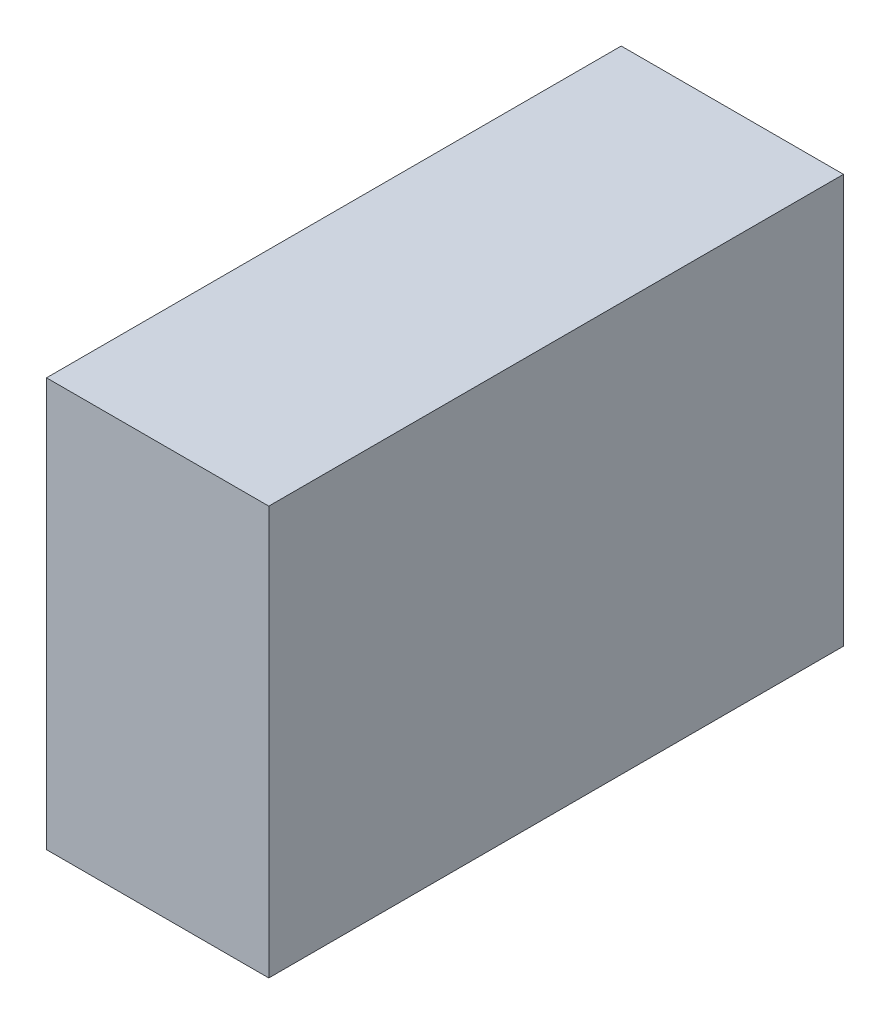
from build123d import *

# Parameters (mm, degrees)
SKETCH2_W           = 65.676202638
SKETCH2_H           = 46.703077432
BOSS_EXTRUDE1_DEPTH = 12.7


with BuildPart() as part:
    # Sketch2 → Boss-Extrude1 (new, symmetric)
    with BuildSketch(Plane(origin=(0, 0, 0), x_dir=(0, 0, -1), z_dir=(1, 0, 0))):
        with Locations((338.550255643, 91.235190265)):
            Rectangle(SKETCH2_W, SKETCH2_H)
    extrude(amount=BOSS_EXTRUDE1_DEPTH, both=True)


solid = part.part
